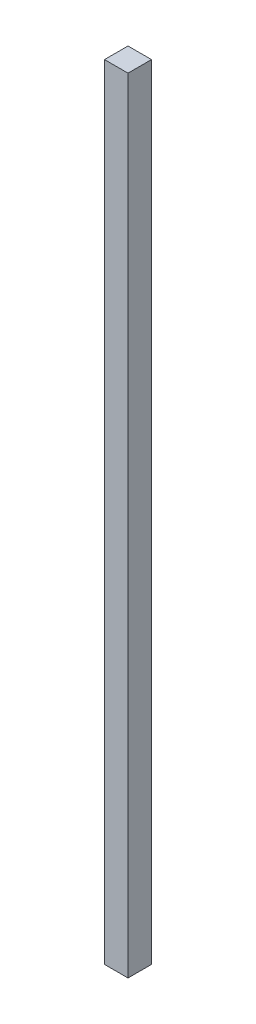
from build123d import *

# Parameters (mm, degrees)
SKETCH_1_W      = 30
SKETCH_1_H      = 30
EXTRUDE_1_DEPTH = 1000


with BuildPart() as part:
    # 스케치1 → 보스-돌출1 (new body)
    with BuildSketch(Plane(origin=(0, 0, 0), x_dir=(1, 0, 0), z_dir=(0, 1, 0))):
        with Locations((15, 15)):
            Rectangle(SKETCH_1_W, SKETCH_1_H)
    extrude(amount=EXTRUDE_1_DEPTH)


solid = part.part
